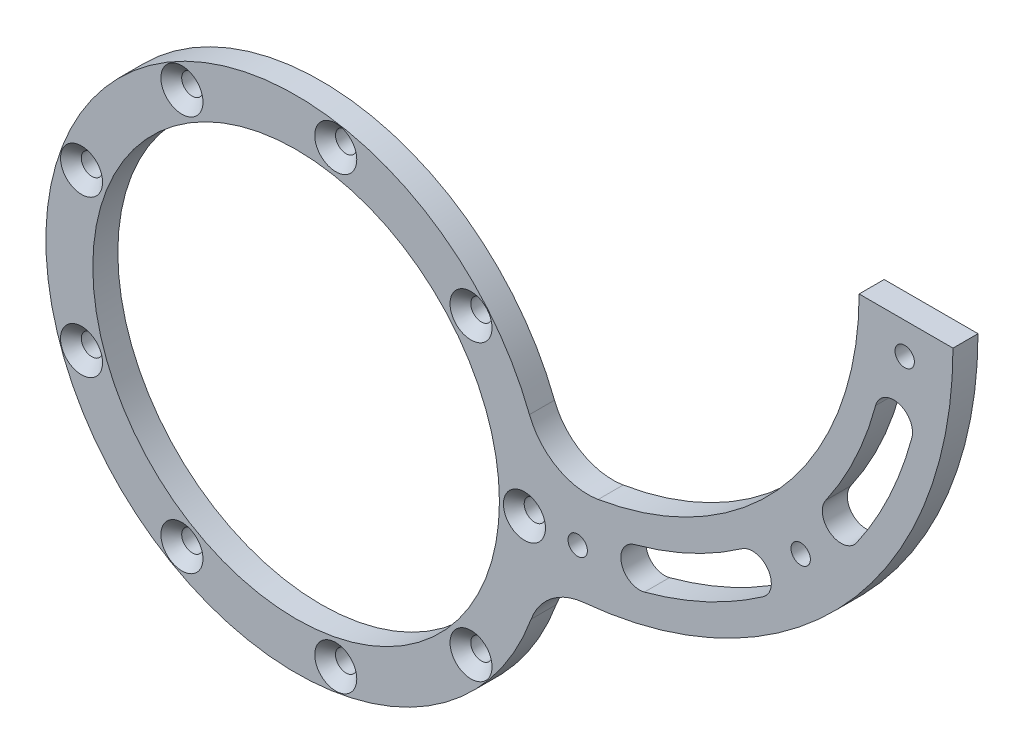
from build123d import *

# Parameters (mm, degrees)
SKETCH_1_R                   = 40
SKETCH_1_R_2                 = 32.5
EXTRUDE_1_DEPTH              = 4
HOLE_WIZARD_M3_1_D           = 3.4
HOLE_WIZARD_M3_1_CSINK_D     = 6.72
HOLE_WIZARD_M3_1_CSINK_ANGLE = 90
EXTRUDE_START                = -4
SKETCH_4_R                   = 1.55
EXTRUDE_2_DEPTH              = 4
FILLET_1_R                   = 10


with BuildPart() as part:
    # 草图1 → 凸台-拉伸1 (new body)
    with BuildSketch(Plane.XY):
        Circle(SKETCH_1_R)
        Circle(SKETCH_1_R_2, mode=Mode.SUBTRACT)
    extrude(amount=EXTRUDE_1_DEPTH)

    # M3 六角凹锥坑螺钉的锥形沉头孔1 (through all)
    with Locations(Plane.XY.offset(4)):
        with Locations((27.960622174, 23.461747754), (36.5, 0), (27.960622174, -23.461747754), (6.338158485, -35.945482985), (-18.25, -31.609927238), (-34.298780659, -12.483735231), (-34.298780659, 12.483735231), (-18.25, 31.609927238), (6.338158485, 35.945482985)):
            CounterSinkHole(HOLE_WIZARD_M3_1_D / 2, HOLE_WIZARD_M3_1_CSINK_D / 2, counter_sink_angle=HOLE_WIZARD_M3_1_CSINK_ANGLE)

    # 草图4 → 凸台-拉伸2 (add)
    with BuildSketch(Plane.XY.offset(4).offset(EXTRUDE_START)):
        with BuildLine():
            Line((90, 57.5), (105, 57.5))
            ThreePointArc((105, 57.5), (85.710698364, 11.288182733), (39.291321381, -7.496136613))
            ThreePointArc((39.291321381, -7.496136613), (39.999999743, 0.004535468), (39.289620447, 7.505046646))
            ThreePointArc((39.289620447, 7.505046646), (75.103283481, 21.894389644), (90, 57.5))
        make_face()
        with Locations((45.011455208, 0.21880486)):
            Circle(SKETCH_4_R, mode=Mode.SUBTRACT)
        with Locations((80.658639918, 16.841360082)):
            Circle(SKETCH_4_R, mode=Mode.SUBTRACT)
        with Locations((97.28119514, 52.488544792)):
            Circle(SKETCH_4_R, mode=Mode.SUBTRACT)
        with BuildLine():
            ThreePointArc((55.681924073, -0.932245014), (65.568404835, 2.668378884), (74.681550102, 7.927426106))
            ThreePointArc((74.681550102, 7.927426106), (75.419947976, 12.105316552), (71.24205753, 12.843714426))
            ThreePointArc((71.24205753, 12.843714426), (63.032695265, 8.106225607), (54.126691933, 4.862688376))
            ThreePointArc((54.126691933, 4.862688376), (52.006841308, 1.187605611), (55.681924073, -0.932245014))
        make_face(mode=Mode.SUBTRACT)
        with BuildLine():
            ThreePointArc((89.572573894, 22.818449898), (94.831621116, 31.931595165), (98.432245014, 41.818075927))
            ThreePointArc((98.432245014, 41.818075927), (96.312394389, 45.493158692), (92.637311624, 43.373308067))
            ThreePointArc((92.637311624, 43.373308067), (89.393774393, 34.467304735), (84.656285574, 26.25794247))
            ThreePointArc((84.656285574, 26.25794247), (85.394683448, 22.080052024), (89.572573894, 22.818449898))
        make_face(mode=Mode.SUBTRACT)
    extrude(amount=EXTRUDE_2_DEPTH)

    # 圆角1
    fillet_1_edges = [part.edges().sort_by_distance(p)[0] for p in [
        (39.289620447, 7.505046646, 2),
        (39.291321381, -7.496136613, 2),
    ]]
    fillet(fillet_1_edges, radius=FILLET_1_R)


solid = part.part
